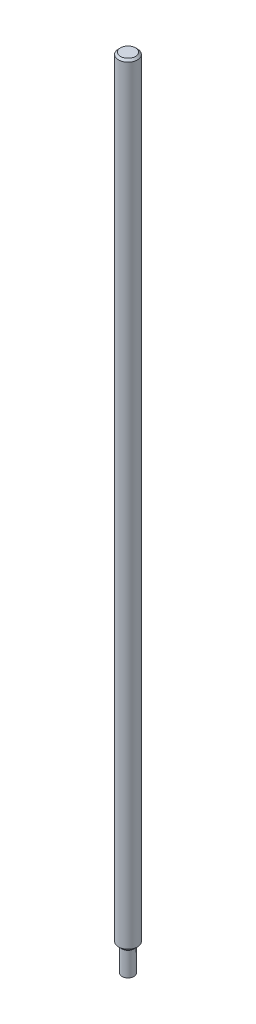
from build123d import *

# Parameters (mm, degrees)
CHAMFER1_SIZE = 0.5


with BuildPart() as part:
    # Sketch1 → Revolve1 (revolve)
    with BuildSketch(Plane(origin=(0, 0, 0), x_dir=(0, 0, -1), z_dir=(1, 0, 0))):
        Polygon((0, 100), (0, -100), (-1.5, -100), (-1.5, -94), (-2.38, -93.12), (-2.38, 100), align=None)
    revolve(axis=Axis((0, 100, 0), (0, -1, 0)))

    # Chamfer1
    chamfer1_edges = [part.edges().sort_by_distance(p)[0] for p in [
        (0, 100, -2.38),
    ]]
    chamfer(chamfer1_edges, length=CHAMFER1_SIZE)


solid = part.part
